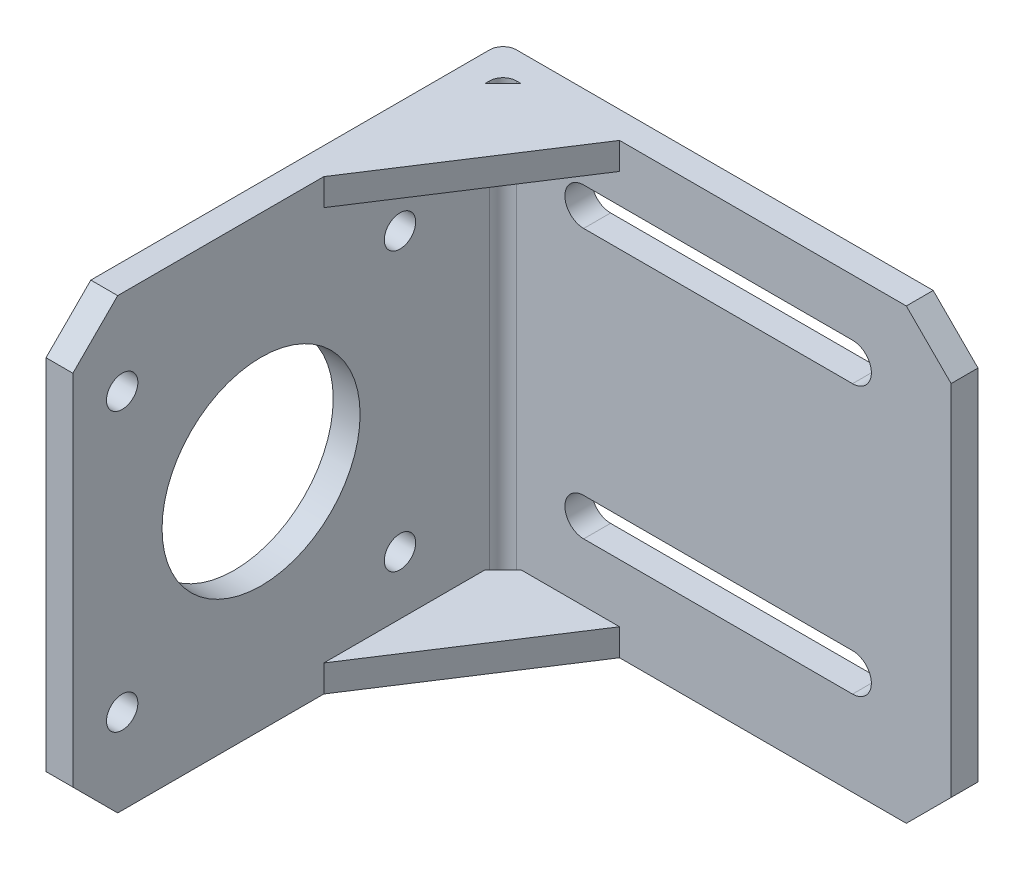
from build123d import *

# Parameters (mm, degrees)
ESQUISSE1_W                = 53
ESQUISSE1_H                = 50
BOSS_EXTRU_1_DEPTH         = 3
ESQUISSE2_W                = 3
ESQUISSE2_H                = 50
BOSS_EXTRU_2_DEPTH         = 48
ESQUISSE3_R                = 11.05
ESQUISSE3_R_2              = 1.75
ENL_V_MAT_EXTRU_1_DEPTH    = 49
CHANFREIN1_SIZE            = 5
BOSS_EXTRU_3_DEPTH         = 3
R_P_TITION_LIN_AIRE1_COUNT = 2
R_P_TITION_LIN_AIRE1_PITCH = 47
CONG_3_R                   = 1.5


with BuildPart() as part:
    # Esquisse1 → Boss.-Extru.1 (new body)
    with BuildSketch(Plane.XY):
        with Locations((53.536991909, -25)):
            Rectangle(ESQUISSE1_W, ESQUISSE1_H)
        with BuildLine():
            Line((39.036991909, -10.508361759), (69.036991909, -10.508361759))
            ThreePointArc((69.036991909, -10.508361759), (71.136991909, -8.408361759), (69.036991909, -6.308361759))
            Line((69.036991909, -6.308361759), (39.036991909, -6.308361759))
            ThreePointArc((39.036991909, -6.308361759), (36.936991909, -8.408361759), (39.036991909, -10.508361759))
        make_face(mode=Mode.SUBTRACT)
        with BuildLine():
            Line((39.036991909, -36.308361759), (69.036991909, -36.308361759))
            ThreePointArc((69.036991909, -36.308361759), (71.136991909, -38.408361759), (69.036991909, -40.508361759))
            Line((69.036991909, -40.508361759), (39.036991909, -40.508361759))
            ThreePointArc((39.036991909, -40.508361759), (36.936991909, -38.408361759), (39.036991909, -36.308361759))
        make_face(mode=Mode.SUBTRACT)
    extrude(amount=BOSS_EXTRU_1_DEPTH)

    # Esquisse2 → Boss.-Extru.2 (add)
    with BuildSketch(Plane.XY.offset(3)):
        with Locations((28.536991909, -25)):
            Rectangle(ESQUISSE2_W, ESQUISSE2_H)
    extrude(amount=BOSS_EXTRU_2_DEPTH)

    # Esquisse3 → Enlèv. mat.-Extru.1 (cut)
    with BuildSketch(Plane.ZY.offset(-27.036991909)):
        with Locations(Location((30, -25, 0), (0, 0, 270))):
            Circle(ESQUISSE3_R)
        with Locations(Location((14.5, -9.5, 0), (0, 0, 270))):
            Circle(ESQUISSE3_R_2)
        with Locations(Location((45.5, -9.5, 0), (0, 0, 270))):
            Circle(ESQUISSE3_R_2)
        with Locations(Location((45.5, -40.5, 0), (0, 0, 270))):
            Circle(ESQUISSE3_R_2)
        with Locations(Location((14.5, -40.5, 0), (0, 0, 270))):
            Circle(ESQUISSE3_R_2)
    extrude(amount=-ENL_V_MAT_EXTRU_1_DEPTH, mode=Mode.SUBTRACT)

    # Chanfrein1
    chanfrein1_edges = [part.edges().sort_by_distance(p)[0] for p in [
        (80.036991909, -50, 1.5),
        (80.036991909, 0, 1.5),
        (28.536991909, -50, 51),
        (28.536991909, 0, 51),
    ]]
    chamfer(chanfrein1_edges, length=CHANFREIN1_SIZE)

    # Esquisse4 → Boss.-Extru.3 (add)
    with BuildSketch(Plane.XZ.offset(50)):
        Polygon((30.036991909, 5), (32.036991909, 3), (43.036991909, 3), (30.036991909, 23), align=None)
    boss_extru_3 = extrude(amount=-BOSS_EXTRU_3_DEPTH)

    # Répétition linéaire1: Boss.-Extru.3 ×2
    with Locations(*[(0, i * R_P_TITION_LIN_AIRE1_PITCH, 0) for i in range(1, R_P_TITION_LIN_AIRE1_COUNT)]):
        add(boss_extru_3)

    # Congé3
    cong_3_edges = [part.edges().sort_by_distance(p)[0] for p in [
        (27.036991909, -25, 0),
        (30.036991909, -25, 3),
    ]]
    fillet(cong_3_edges, radius=CONG_3_R)


solid = part.part
